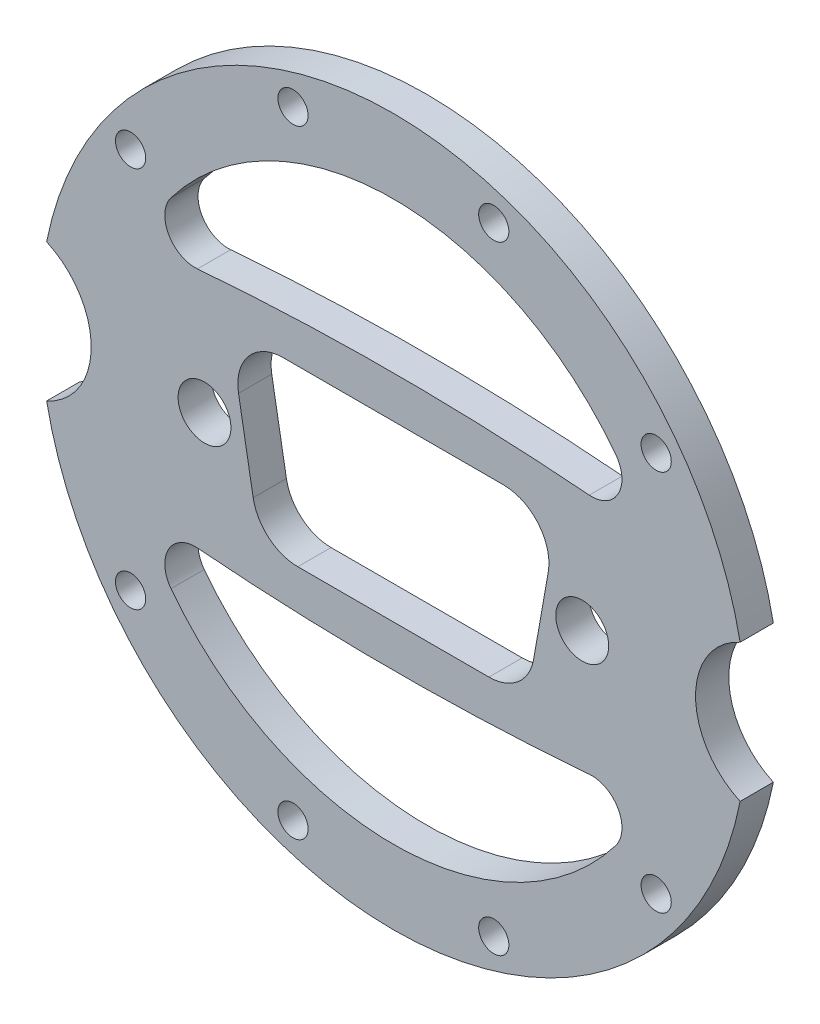
from build123d import *

# Parameters (mm, degrees)
SKIZZE1_R                       = 23.4
SKIZZE1_R_2                     = 1
LINEAR_AUSTRAGEN1_DEPTH         = 2.2
SKIZZE3_R                       = 1.75
SCHNITT_LINEAR_AUSTRAGEN3_DEPTH = 34.165644875
SKETCH1_R                       = 5
CUT_EXTRUDE1_DEPTH              = 3


with BuildPart() as part:
    # Skizze1 → Linear austragen1 (new body)
    with BuildSketch(Plane.XY):
        Circle(SKIZZE1_R)
        with Locations((6.643865379, 20.4477151)):
            Circle(SKIZZE1_R_2, mode=Mode.SUBTRACT)
        with Locations((17.393865379, 12.637382924)):
            Circle(SKIZZE1_R_2, mode=Mode.SUBTRACT)
        with Locations((17.393865379, -12.637382924)):
            Circle(SKIZZE1_R_2, mode=Mode.SUBTRACT)
        with Locations((-6.643865379, 20.4477151)):
            Circle(SKIZZE1_R_2, mode=Mode.SUBTRACT)
        with Locations((6.643865379, -20.4477151)):
            Circle(SKIZZE1_R_2, mode=Mode.SUBTRACT)
        with Locations((-6.643865379, -20.4477151)):
            Circle(SKIZZE1_R_2, mode=Mode.SUBTRACT)
        with Locations((-17.393865379, -12.637382924)):
            Circle(SKIZZE1_R_2, mode=Mode.SUBTRACT)
        with Locations((-17.393865379, 12.637382924)):
            Circle(SKIZZE1_R_2, mode=Mode.SUBTRACT)
        with BuildLine():
            ThreePointArc((14.720859381, 11.20474449), (0, 18.5), (-14.720859381, 11.20474449))
            ThreePointArc((-14.720859381, 11.20474449), (-14.883940446, 9.033399462), (-12.967323579, 8))
            ThreePointArc((-12.967323579, 8), (0, 8.526339105), (12.967323579, 8))
            ThreePointArc((12.967323579, 8), (14.883940446, 9.033399462), (14.720859381, 11.20474449))
        make_face(mode=Mode.SUBTRACT)
        with BuildLine():
            ThreePointArc((-14.720859381, -11.20474449), (0, -18.5), (14.720859381, -11.20474449))
            ThreePointArc((14.720859381, -11.20474449), (14.883940446, -9.033399462), (12.967323579, -8))
            ThreePointArc((12.967323579, -8), (0, -8.526339105), (-12.967323579, -8))
            ThreePointArc((-12.967323579, -8), (-14.883940446, -9.033399462), (-14.720859381, -11.20474449))
        make_face(mode=Mode.SUBTRACT)
    extrude(amount=LINEAR_AUSTRAGEN1_DEPTH)

    # Skizze3 → Schnitt-Linear austragen3 (cut, through all)
    with BuildSketch(Plane.XY.offset(2.2)):
        with Locations((12.5, 0)):
            Circle(SKIZZE3_R)
        with Locations(Location((-12.5, 0, 0), (0, 0, 180))):
            Circle(SKIZZE3_R)
        with BuildLine():
            Line((-7.295576741, 5.75), (7.295576741, 5.75))
            ThreePointArc((7.295576741, 5.75), (9.59371007, 4.678362829), (10.25, 2.229055467))
            Line((10.25, 2.229055467), (9.280201606, -3.270944533))
            ThreePointArc((9.280201606, -3.270944533), (8.254141176, -5.048133329), (6.325778347, -5.75))
            Line((6.325778347, -5.75), (-6.325778347, -5.75))
            ThreePointArc((-6.325778347, -5.75), (-8.254141176, -5.048133329), (-9.280201606, -3.270944533))
            Line((-9.280201606, -3.270944533), (-10.25, 2.229055467))
            ThreePointArc((-10.25, 2.229055467), (-9.59371007, 4.678362829), (-7.295576741, 5.75))
        make_face()
    extrude(amount=-SCHNITT_LINEAR_AUSTRAGEN3_DEPTH, mode=Mode.SUBTRACT)

    # Sketch1 → Cut-Extrude1 (cut)
    with BuildSketch(Plane.XY):
        with Locations((-25, 0)):
            Circle(SKETCH1_R)
        with Locations((25, 0)):
            Circle(SKETCH1_R)
    extrude(amount=CUT_EXTRUDE1_DEPTH, mode=Mode.SUBTRACT)


solid = part.part
